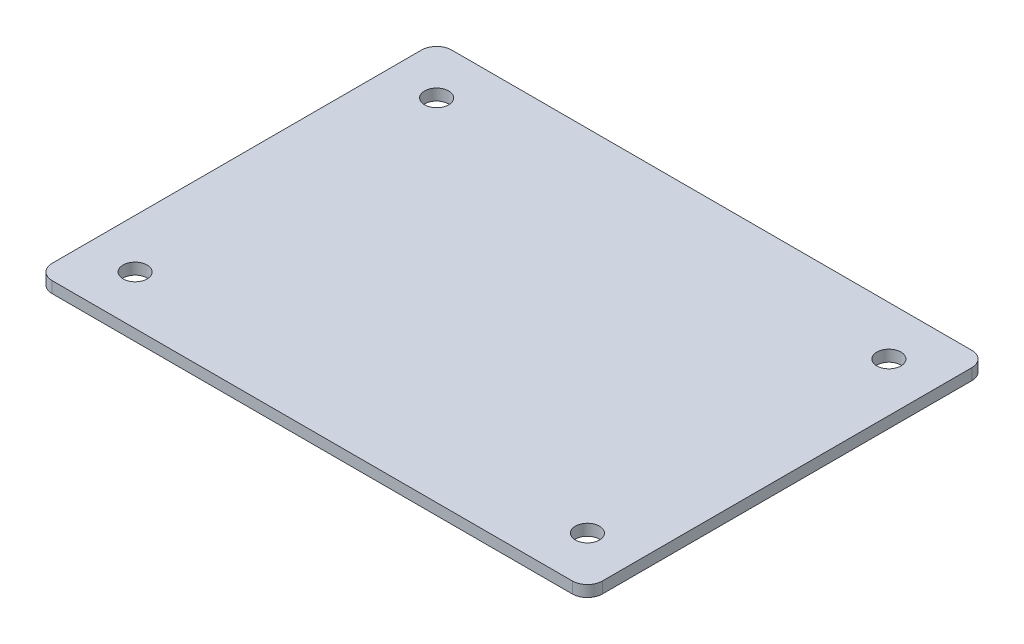
from build123d import *

# Parameters (mm, degrees)
SKETCH_1_W                  = 73
SKETCH_1_H                  = 53
EXTRUDE_1_DEPTH             = 1.5
FILLET_1_R                  = 2
SKETCH_2_R                  = 1.6
CUT_EXTRUDE_1_DEPTH         = 46.130366717
PATTERN_LINEAR_1_COUNT      = 2
PATTERN_LINEAR_1_PITCH      = 60
PATTERN_LINEAR_1_COUNT_DIR2 = 2
PATTERN_LINEAR_1_PITCH_DIR2 = 40


with BuildPart() as part:
    # 草图1 → 凸台-拉伸1 (new body)
    with BuildSketch(Plane(origin=(0, 0, 0), x_dir=(1, 0, 0), z_dir=(0, 1, 0))):
        Rectangle(SKETCH_1_W, SKETCH_1_H)
    extrude(amount=EXTRUDE_1_DEPTH)

    # 圆角1
    fillet_1_edges = [part.edges().sort_by_distance(p)[0] for p in [
        (-36.5, 0.75, -26.5),
        (36.5, 0.75, -26.5),
        (36.5, 0.75, 26.5),
        (-36.5, 0.75, 26.5),
    ]]
    fillet(fillet_1_edges, radius=FILLET_1_R)

    # 草图2 → 切除-拉伸1 (cut, through all)
    with BuildSketch(Plane(origin=(0, 1.5, 0), x_dir=(1, 0, 0), z_dir=(0, 1, 0))):
        with Locations(Location((-30, 20, 0), (0, 0, 270))):
            Circle(SKETCH_2_R)
    cut_extrude_1 = extrude(amount=-CUT_EXTRUDE_1_DEPTH, mode=Mode.SUBTRACT)

    # 阵列(线性)1: Cut-Extrude 1 2 × 2
    with Locations(*[(i * PATTERN_LINEAR_1_PITCH, 0, j * PATTERN_LINEAR_1_PITCH_DIR2) for i in range(PATTERN_LINEAR_1_COUNT) for j in range(PATTERN_LINEAR_1_COUNT_DIR2) if (i, j) != (0, 0)]):
        add(cut_extrude_1, mode=Mode.SUBTRACT)


solid = part.part
